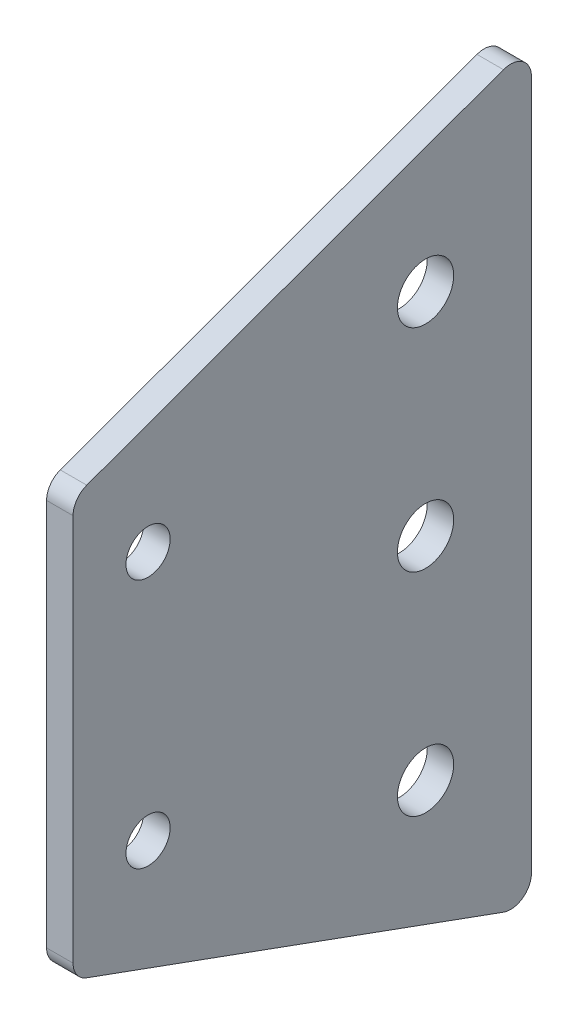
from build123d import *

# Parameters (mm, degrees)
F_1_8_INCH_SHEET_DEPTH     = 1.5875
M5_CLEARANCE_HOLE1_D       = 5.3
F_1_4_IN_CLEARANCE_HOLE1_D = 6.7564
FILLET1_R                  = 2.5


with BuildPart() as part:
    # Sketch1 → 1/8 Inch Sheet (new, symmetric)
    with BuildSketch(Plane(origin=(0, 0, 0), x_dir=(0, 0, -1), z_dir=(1, 0, 0))):
        Polygon((-27.5, 25), (-27.5, -25), (27.5, -45), (27.5, 45), align=None)
    extrude(amount=F_1_8_INCH_SHEET_DEPTH, both=True)

    # M5 Clearance Hole1 (through all)
    with Locations(Plane(origin=(1.5875, 0, 0), x_dir=(0, 0, -1), z_dir=(1, 0, 0))):
        with Locations((-18.5, 15), (-18.5, -15)):
            Hole(M5_CLEARANCE_HOLE1_D / 2)

    # 1/4 in Clearance Hole1 (through all)
    with Locations(Plane(origin=(1.5875, 0, 0), x_dir=(0, 0, -1), z_dir=(1, 0, 0))):
        with Locations((14.8, 25.4), (14.8, 0), (14.8, -25.4)):
            Hole(F_1_4_IN_CLEARANCE_HOLE1_D / 2)

    # Fillet1
    fillet1_edges = [part.edges().sort_by_distance(p)[0] for p in [
        (0, 45, -27.5),
        (0, -45, -27.5),
        (0, -25, 27.5),
        (0, 25, 27.5),
    ]]
    fillet(fillet1_edges, radius=FILLET1_R)


solid = part.part
